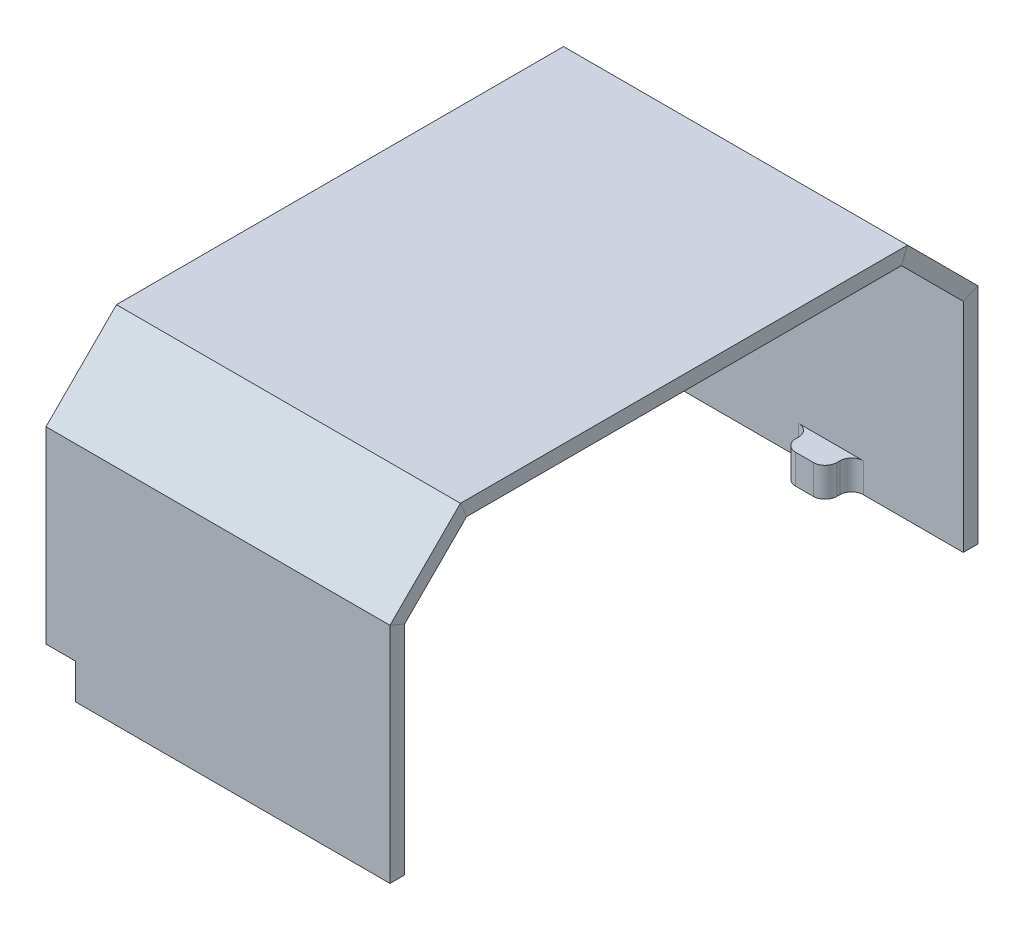
from build123d import *

# Parameters (mm, degrees)
SKETCH1_W           = 100
SKETCH1_H           = 5
BOSS_EXTRUDE1_DEPTH = 17
SKETCH6_W           = 10
SKETCH6_H           = 12
CUT_EXTRUDE1_DEPTH  = 234.428789998
SKETCH7_W           = 14
SKETCH7_H           = 14
BOSS_EXTRUDE2_DEPTH = 10
SKETCH8_R           = 6
CUT_EXTRUDE2_DEPTH  = 2
FILLET1_R           = 4
SKETCH9_W           = 14
SKETCH9_H           = 14
BOSS_EXTRUDE3_DEPTH = 10
SKETCH10_R          = 6
CUT_EXTRUDE3_DEPTH  = 2
FILLET2_R           = 4


with BuildPart() as part:
    # Sweep3: sweep along a path in Sketch2
    with BuildLine(Plane(origin=(0, 0, 0), x_dir=(0, 0, -1), z_dir=(1, 0, 0))) as sweep3_path:
        Line((-97.5, 0), (-97.5, 75))
        Line((-97.5, 75), (-75, 97.5))
        Line((-75, 97.5), (75, 97.5))
        Line((75, 97.5), (97.5, 75))
        Line((97.5, 75), (97.5, 0))
    # Sketch1 → Sweep3 (sweep)
    with BuildSketch(Plane(origin=(0, 0, 0), x_dir=(1, 0, 0), z_dir=(0, 1, 0))):
        with Locations((0, -97.5)):
            Rectangle(SKETCH1_W, SKETCH1_H)
    sweep(path=sweep3_path.line, transition=Transition.RIGHT)

    # Sketch5 → Boss-Extrude1 (add)
    with BuildSketch(Plane.ZY.offset(50)):
        Polygon((-100, 0), (-95, 0), (-95, 73.964466094), (-73.964466094, 95), (73.964466094, 95), (95, 73.964466094), (95, 0), (100, 0), (100, 76.035533906), (76.035533906, 100), (-76.035533906, 100), (-100, 76.035533906), align=None)
    extrude(amount=BOSS_EXTRUDE1_DEPTH)

    # Sketch6 → Cut-Extrude1 (cut, through all)
    with BuildSketch(Plane(origin=(0, 0, -100), x_dir=(-1, 0, 0), z_dir=(0, 0, -1))):
        with Locations((62, 6)):
            Rectangle(SKETCH6_W, SKETCH6_H)
    extrude(amount=-CUT_EXTRUDE1_DEPTH, mode=Mode.SUBTRACT)

    # Sketch7 → Boss-Extrude2 (add)
    with BuildSketch(Plane.XZ):
        with Locations((5, 93)):
            Rectangle(SKETCH7_W, SKETCH7_H)
    extrude(amount=-BOSS_EXTRUDE2_DEPTH)

    # Sketch8 → Cut-Extrude2 (cut)
    with BuildSketch(Plane.XZ):
        with Locations(Location((5, 93, 0), (0, 0, 270))):
            Circle(SKETCH8_R)
    extrude(amount=-CUT_EXTRUDE2_DEPTH, mode=Mode.SUBTRACT)

    # Fillet1
    fillet1_edges = [part.edges().sort_by_distance(p)[0] for p in [
        (12, 5, 95),
        (-2, 5, 95),
        (-2, 5, 86),
        (12, 5, 86),
    ]]
    fillet(fillet1_edges, radius=FILLET1_R)

    # Sketch9 → Boss-Extrude3 (add)
    with BuildSketch(Plane.XZ):
        with Locations((5, -93)):
            Rectangle(SKETCH9_W, SKETCH9_H)
    extrude(amount=-BOSS_EXTRUDE3_DEPTH)

    # Sketch10 → Cut-Extrude3 (cut)
    with BuildSketch(Plane.XZ):
        with Locations(Location((5, -93, 0), (0, 0, 270))):
            Circle(SKETCH10_R)
    extrude(amount=-CUT_EXTRUDE3_DEPTH, mode=Mode.SUBTRACT)

    # Fillet2
    fillet2_edges = [part.edges().sort_by_distance(p)[0] for p in [
        (12, 5, -86),
        (-2, 5, -95),
        (-2, 5, -86),
        (12, 5, -95),
    ]]
    fillet(fillet2_edges, radius=FILLET2_R)


solid = part.part
